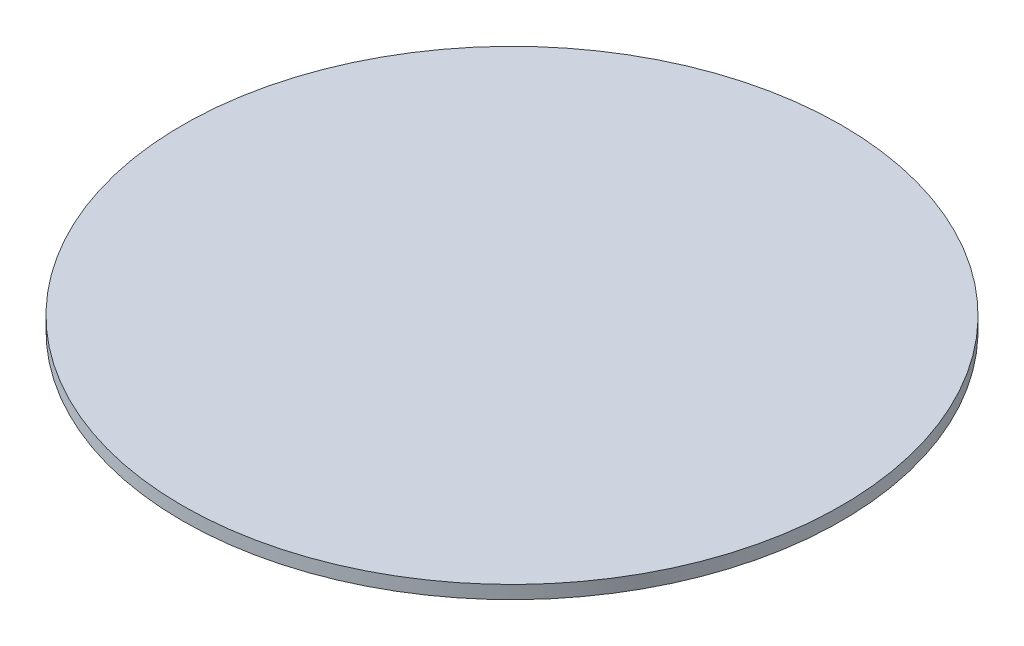
from build123d import *

# Parameters (mm, degrees)
SKETCH1_R           = 75
BOSS_EXTRUDE2_DEPTH = 3


with BuildPart() as part:
    # Sketch1 → Boss-Extrude2 (new body)
    with BuildSketch(Plane(origin=(0, 0, 0), x_dir=(1, 0, 0), z_dir=(0, 1, 0))):
        with Locations(Location((0, 0, 0), (0, 0, 270))):
            Circle(SKETCH1_R)
    extrude(amount=BOSS_EXTRUDE2_DEPTH)


solid = part.part
